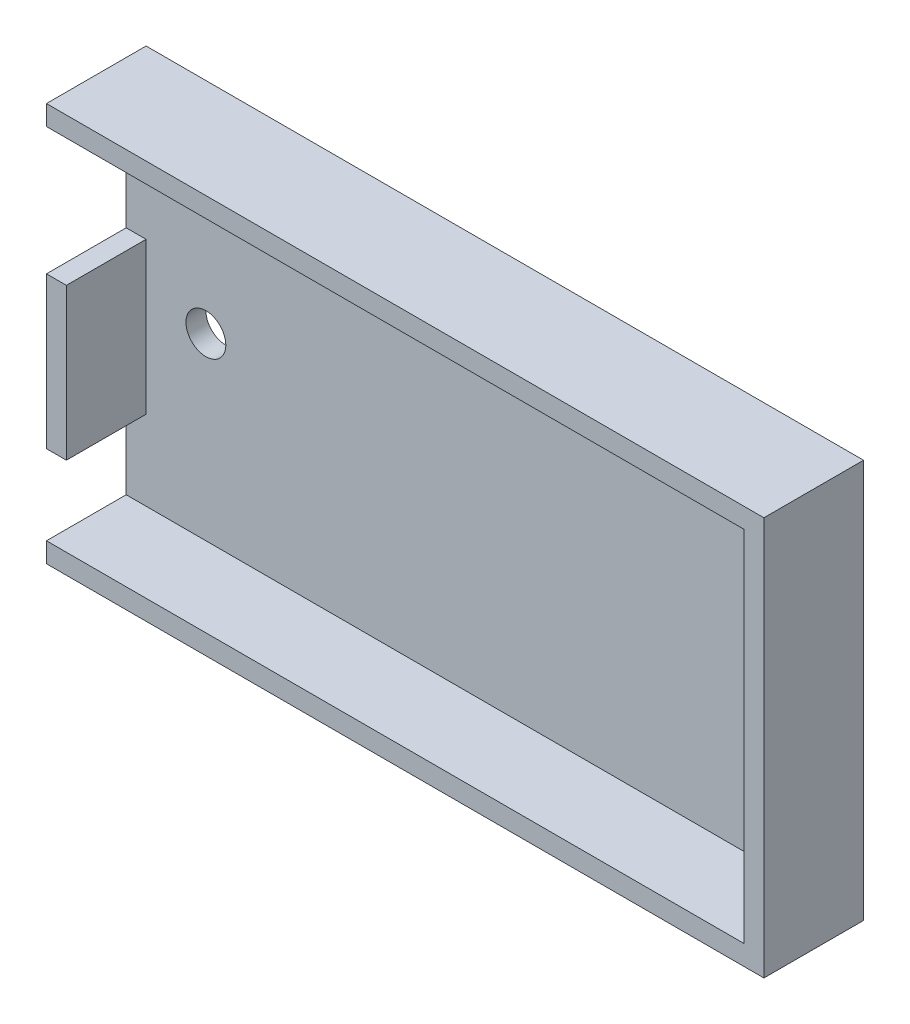
from build123d import *

# Parameters (mm, degrees)
SKETCH1_W           = 114.3
SKETCH1_H           = 63.5
BOSS_EXTRUDE1_DEPTH = 3.175
SKETCH2_W           = 114.3
SKETCH2_H           = 63.5
SKETCH2_W_2         = 107.95
SKETCH2_H_2         = 57.15
BOSS_EXTRUDE2_DEPTH = 12.7
CUT_EXTRUDE1_REACH  = 121.685
SKETCH3_W           = 12.7
SKETCH3_H           = 12.7
SKETCH3_H_2         = 20.32
CUT_EXTRUDE2_REACH  = 68.599
SKETCH4_R           = 3.175


with BuildPart() as part:
    # Sketch1 → Boss-Extrude1 (new body)
    with BuildSketch(Plane.XY):
        Rectangle(SKETCH1_W, SKETCH1_H)
    extrude(amount=BOSS_EXTRUDE1_DEPTH)

    # Sketch2 → Boss-Extrude2 (add)
    with BuildSketch(Plane.XY.offset(3.175)):
        Rectangle(SKETCH2_W, SKETCH2_H)
        Rectangle(SKETCH2_W_2, SKETCH2_H_2, mode=Mode.SUBTRACT)
    extrude(amount=BOSS_EXTRUDE2_DEPTH)

    # Sketch3 → Cut-Extrude1 (cut, up to next)
    with BuildSketch(Plane.ZY.offset(57.15), mode=Mode.PRIVATE) as cut_extrude1_sk1:
        with Locations((9.525, -22.225)):
            Rectangle(SKETCH3_W, SKETCH3_H)
    cut_extrude1_tool1 = extrude(cut_extrude1_sk1.sketch, amount=-CUT_EXTRUDE1_REACH, mode=Mode.PRIVATE) & part.part
    # Sketch3 → Cut-Extrude1 (cut, up to next)
    with BuildSketch(Plane.ZY.offset(57.15), mode=Mode.PRIVATE) as cut_extrude1_sk2:
        with Locations((9.525, 18.415)):
            Rectangle(SKETCH3_W, SKETCH3_H_2)
    cut_extrude1_tool2 = extrude(cut_extrude1_sk2.sketch, amount=-CUT_EXTRUDE1_REACH, mode=Mode.PRIVATE) & part.part
    add(cut_extrude1_tool1.solids().sort_by_distance((-57.15, -22.225, 9.525))[0], mode=Mode.SUBTRACT)
    add(cut_extrude1_tool2.solids().sort_by_distance((-57.15, 18.415, 9.525))[0], mode=Mode.SUBTRACT)

    # Sketch4 → Cut-Extrude2 (cut, up to next)
    with BuildSketch(Plane.XY.offset(3.175), mode=Mode.PRIVATE) as cut_extrude2_sk1:
        with Locations((-44.45, 0)):
            Circle(SKETCH4_R)
    cut_extrude2_tool1 = extrude(cut_extrude2_sk1.sketch, amount=-CUT_EXTRUDE2_REACH, mode=Mode.PRIVATE) & part.part
    # Sketch4 → Cut-Extrude2 (cut, up to next)
    with BuildSketch(Plane.XY.offset(3.175), mode=Mode.PRIVATE) as cut_extrude2_sk2:
        with Locations((44.45, 0)):
            Circle(SKETCH4_R)
    cut_extrude2_tool2 = extrude(cut_extrude2_sk2.sketch, amount=-CUT_EXTRUDE2_REACH, mode=Mode.PRIVATE) & part.part
    add(cut_extrude2_tool1.solids().sort_by_distance((-44.45, 0, 3.175))[0], mode=Mode.SUBTRACT)
    add(cut_extrude2_tool2.solids().sort_by_distance((44.45, 0, 3.175))[0], mode=Mode.SUBTRACT)


solid = part.part
